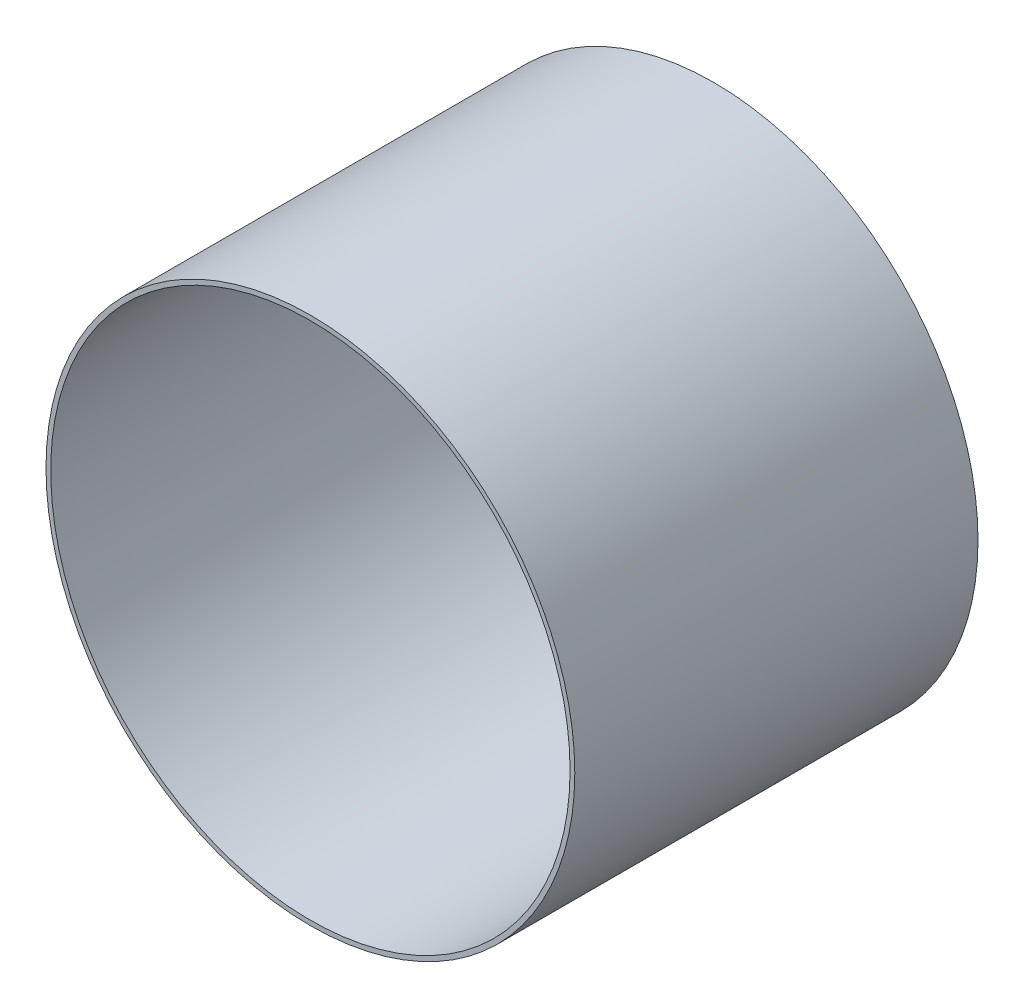
from build123d import *

# Parameters (mm, degrees)
SKETCH1_R      = 71.12
SKETCH1_R_2    = 69.85
EXTRUDE1_DEPTH = 108.458


with BuildPart() as part:
    # Sketch1 → Extrude1 (new body)
    with BuildSketch(Plane.XY):
        Circle(SKETCH1_R)
        Circle(SKETCH1_R_2, mode=Mode.SUBTRACT)
    extrude(amount=EXTRUDE1_DEPTH)


solid = part.part
